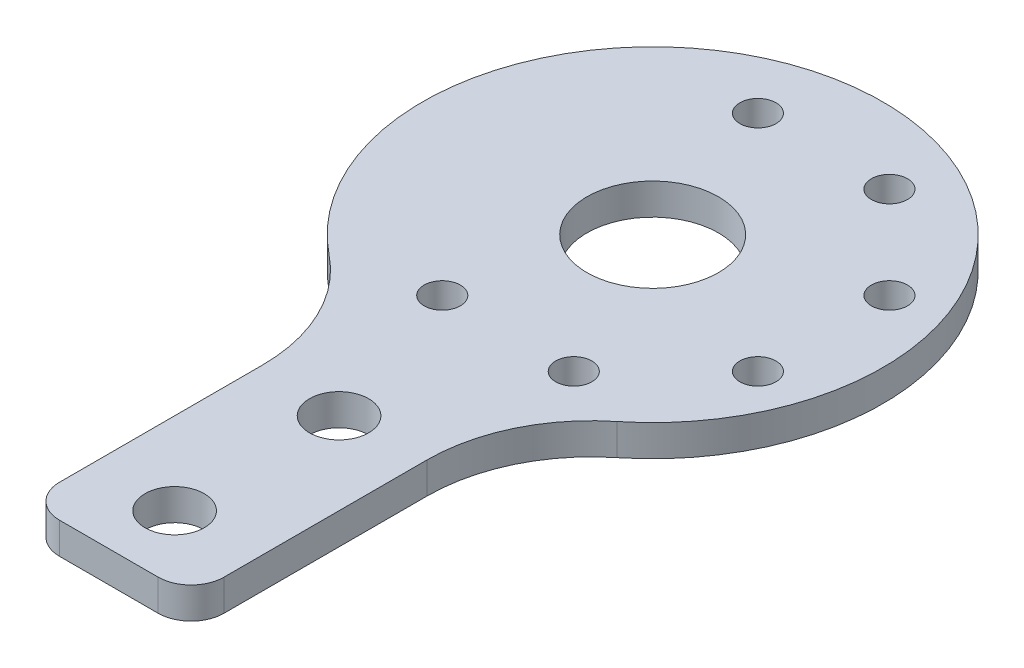
from build123d import *

# Parameters (mm, degrees)
BOSS_EXTRUDE1_DEPTH            = 4.7625
SKETCH5_R                      = 10
CUT_EXTRUDE1_DEPTH             = 90.919995629
M8_CLEARANCE_HOLE1_D           = 9
FILLET1_R                      = 25
M5_CLEARANCE_HOLE1_D           = 5.5
M5_CLEARANCE_HOLE1_CSINK_D     = 5.55
M5_CLEARANCE_HOLE1_CSINK_ANGLE = 90
FILLET2_R                      = 5


with BuildPart() as part:
    # Sketch1 → Boss-Extrude1 (new body)
    with BuildSketch(Plane(origin=(0, 0, 0), x_dir=(1, 0, 0), z_dir=(0, 1, 0))):
        with BuildLine():
            Line((-12.5, -82.691742077), (12.5, -82.691742077))
            Line((12.5, -82.691742077), (12.5, -32.691742077))
            ThreePointArc((12.5, -32.691742077), (0, 35), (-12.5, -32.691742077))
            Line((-12.5, -32.691742077), (-12.5, -82.691742077))
        make_face()
    extrude(amount=BOSS_EXTRUDE1_DEPTH)

    # Sketch5 → Cut-Extrude1 (cut, through all)
    with BuildSketch(Plane.XZ):
        with Locations(Location((0, 0, 0), (0, 0, 270))):
            Circle(SKETCH5_R)
    extrude(amount=-CUT_EXTRUDE1_DEPTH, mode=Mode.SUBTRACT)

    # M8 Clearance Hole1 (through all)
    with Locations(Plane(origin=(0, 0, 0), x_dir=(-1, 0, 0), z_dir=(0, -1, 0))):
        with Locations((0, -47.691742077), (0, -72.691742077)):
            Hole(M8_CLEARANCE_HOLE1_D / 2)

    # Fillet1
    fillet1_edges = [part.edges().sort_by_distance(p)[0] for p in [
        (-12.5, 2.38125, 32.691742077),
        (12.5, 2.38125, 32.691742077),
    ]]
    fillet(fillet1_edges, radius=FILLET1_R)

    # M5 Clearance Hole1 (through all)
    with Locations(Plane(origin=(0, 0, 0), x_dir=(-1, 0, 0), z_dir=(0, -1, 0))):
        with Locations((-12, 24), (8, 24), (-26, 10), (-26, -10), (-12, -24), (8, -24)):
            CounterSinkHole(M5_CLEARANCE_HOLE1_D / 2, M5_CLEARANCE_HOLE1_CSINK_D / 2, counter_sink_angle=M5_CLEARANCE_HOLE1_CSINK_ANGLE)

    # Fillet2
    fillet2_edges = [part.edges().sort_by_distance(p)[0] for p in [
        (12.5, 2.38125, 82.691742077),
        (-12.5, 2.38125, 82.691742077),
    ]]
    fillet(fillet2_edges, radius=FILLET2_R)


solid = part.part
